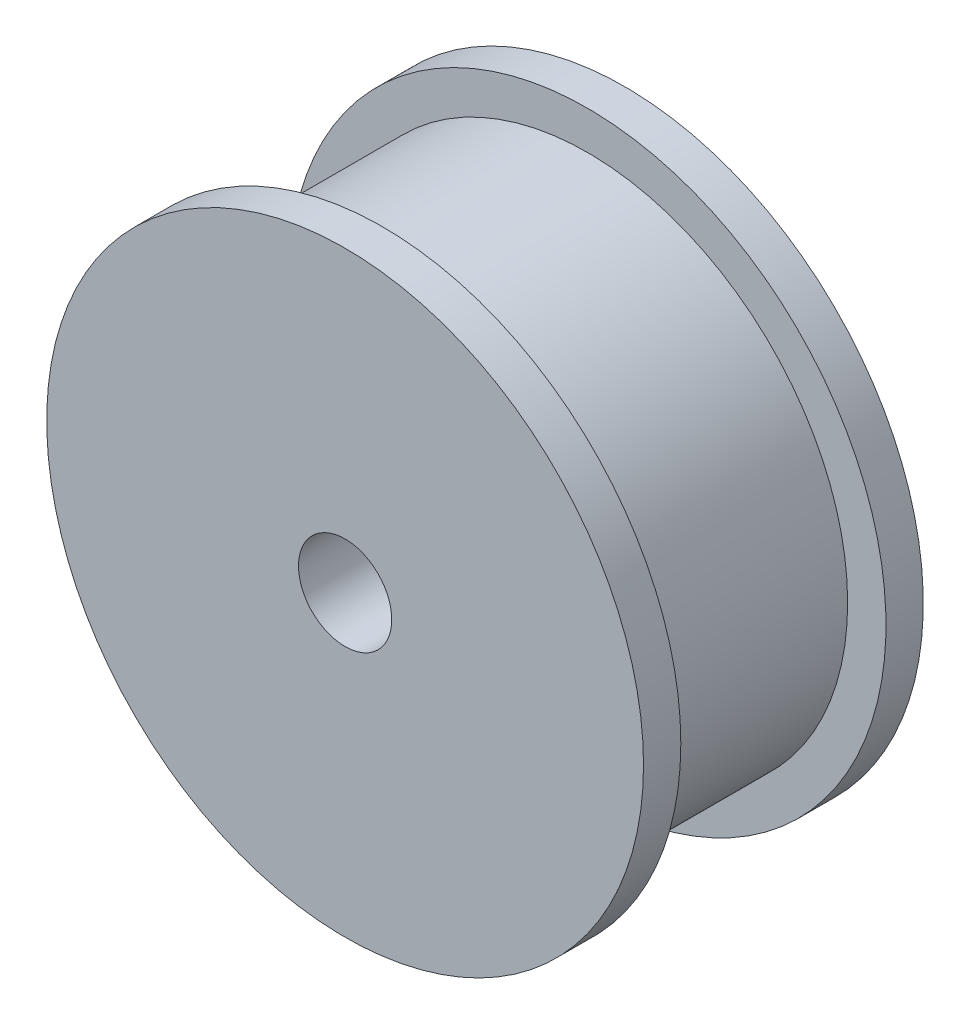
from build123d import *

# Parameters (mm, degrees)
SKETCH_1_R               = 13.945
EXTRUDE_1_DEPTH          = 5.5
SKETCH_2_R               = 16
EXTRUDE_2_DEPTH          = 2
EXTRUDE_START            = 2
SKETCH_3_R               = 16
EXTRUDE_3_DEPTH          = 2
CUT_EXTRUDE_1_DEPTH      = 28.147743921
CUT_EXTRUDE_1_DEPTH_BACK = 28.147743921
SKETCH_4_R               = 2.5


with BuildPart() as part:
    # 草图1 → 凸台-拉伸1 (new, symmetric)
    with BuildSketch(Plane.XY):
        Circle(SKETCH_1_R)
    extrude(amount=EXTRUDE_1_DEPTH, both=True)

    # 草图2 → 凸台-拉伸2 (add)
    with BuildSketch(Plane.XY.offset(5.5)):
        Circle(SKETCH_2_R)
    extrude(amount=EXTRUDE_2_DEPTH)

    # 草图3 → 凸台-拉伸3 (add)
    with BuildSketch(Plane(origin=(0, 0, -5.5), x_dir=(-1, 0, 0), z_dir=(0, 0, -1)).offset(EXTRUDE_START)):
        with Locations(Location((0, 0, 0), (0, 0, 180))):
            Circle(SKETCH_3_R)
    extrude(amount=-EXTRUDE_3_DEPTH)

    # 草图4 → 切除-拉伸1 (cut, two sides: drawn at the far end of the back side and taken through both)
    with BuildSketch(Plane(origin=(0, 0, -7.5), x_dir=(-1, 0, 0), z_dir=(0, 0, -1)).offset(-CUT_EXTRUDE_1_DEPTH_BACK)):
        Circle(SKETCH_4_R)
    extrude(amount=CUT_EXTRUDE_1_DEPTH + CUT_EXTRUDE_1_DEPTH_BACK, mode=Mode.SUBTRACT)


solid = part.part
